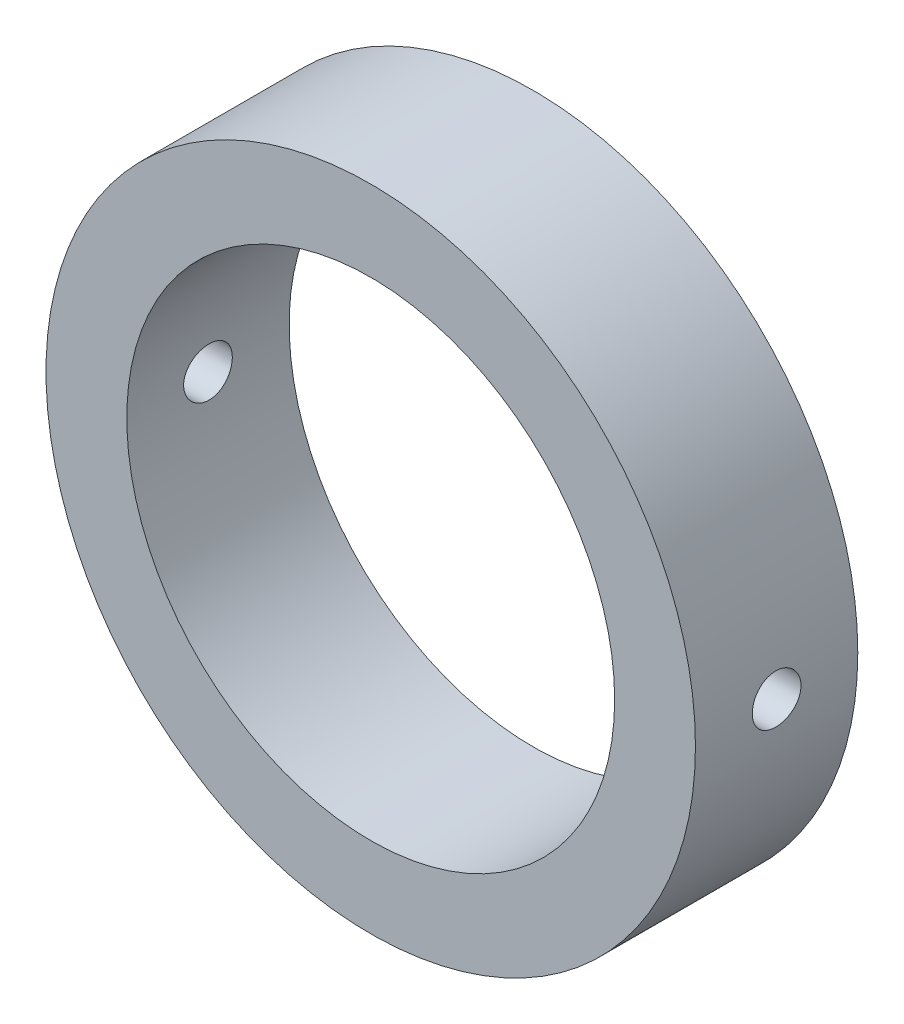
from build123d import *

# Parameters (mm, degrees)
SKETCH1_R               = 20
SKETCH1_R_2             = 15.025
BOSS_EXTRUDE1_DEPTH     = 10
CUT_EXTRUDE1_DEPTH      = 31
CUT_EXTRUDE1_DEPTH_BACK = 31
SKETCH2_R               = 1.5


with BuildPart() as part:
    # Sketch1 → Boss-Extrude1 (new body)
    with BuildSketch(Plane.XY):
        Circle(SKETCH1_R)
        Circle(SKETCH1_R_2, mode=Mode.SUBTRACT)
    extrude(amount=BOSS_EXTRUDE1_DEPTH)

    # Sketch2 → Cut-Extrude1 (cut, two sides: drawn at the far end of the back side and taken through both)
    with BuildSketch(Plane(origin=(0, 0, 0), x_dir=(0, 0, -1), z_dir=(1, 0, 0)).offset(-CUT_EXTRUDE1_DEPTH_BACK)):
        with Locations((-5, 0)):
            Circle(SKETCH2_R)
    extrude(amount=CUT_EXTRUDE1_DEPTH + CUT_EXTRUDE1_DEPTH_BACK, mode=Mode.SUBTRACT)


solid = part.part
